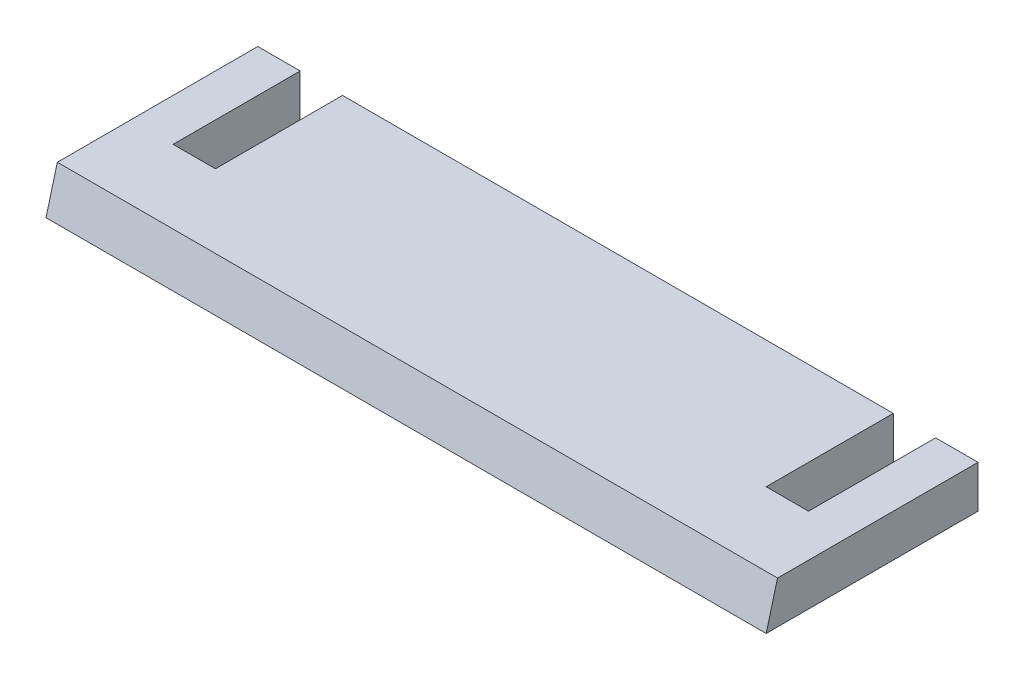
from build123d import *

# Parameters (mm, degrees)
BOSS_EXTRUDE1_DEPTH = 10
DRAFT1_ANGLE        = -15


with BuildPart() as part:
    # Sketch1 → Boss-Extrude1 (new body)
    with BuildSketch(Plane(origin=(0, 0, 0), x_dir=(1, 0, 0), z_dir=(0, 1, 0))):
        Polygon((-75, 25), (-75, -5), (-65, -5), (-65, 25), (65, 25), (65, -5), (75, -5), (75, 25), (85, 25), (85, -25), (-85, -25), (-85, 25), align=None)
    extrude(amount=BOSS_EXTRUDE1_DEPTH)

    # Draft1
    draft1_faces = [part.faces().sort_by_distance(p)[0] for p in [
        (0, 5, 25),
    ]]
    draft(draft1_faces, Plane(origin=(0, 0, 0), x_dir=(0, 0, -1), z_dir=(0, -1, 0)), DRAFT1_ANGLE)


solid = part.part
